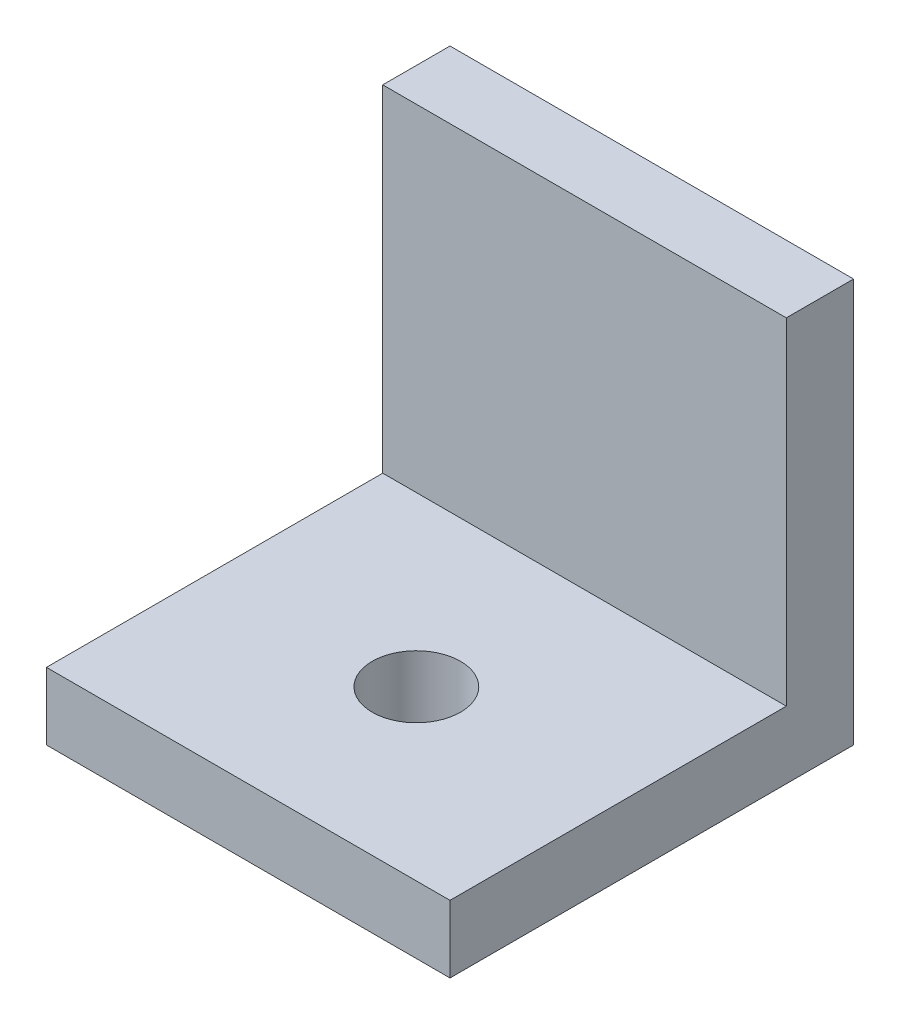
from build123d import *

# Parameters (mm, degrees)
BOSS_EXTRUDE1_DEPTH = 76.2
SKETCH6_R           = 8.334375
CUT_EXTRUDE1_DEPTH  = 12.7


with BuildPart() as part:
    # Sketch2 → Boss-Extrude1 (new body)
    with BuildSketch(Plane(origin=(0, 0, 0), x_dir=(0, 0, -1), z_dir=(1, 0, 0))):
        Polygon((0, 0), (12.7, 0), (12.7, -76.2), (-63.5, -76.2), (-63.5, -63.5), (0, -63.5), align=None)
    extrude(amount=BOSS_EXTRUDE1_DEPTH)

    # Sketch6 → Cut-Extrude1 (cut)
    with BuildSketch(Plane(origin=(0, -63.5, 0), x_dir=(1, 0, 0), z_dir=(0, 1, 0))):
        with Locations(Location((38.1, -31.75, 0), (0, 0, 270))):
            Circle(SKETCH6_R)
    extrude(amount=-CUT_EXTRUDE1_DEPTH, mode=Mode.SUBTRACT)


solid = part.part
